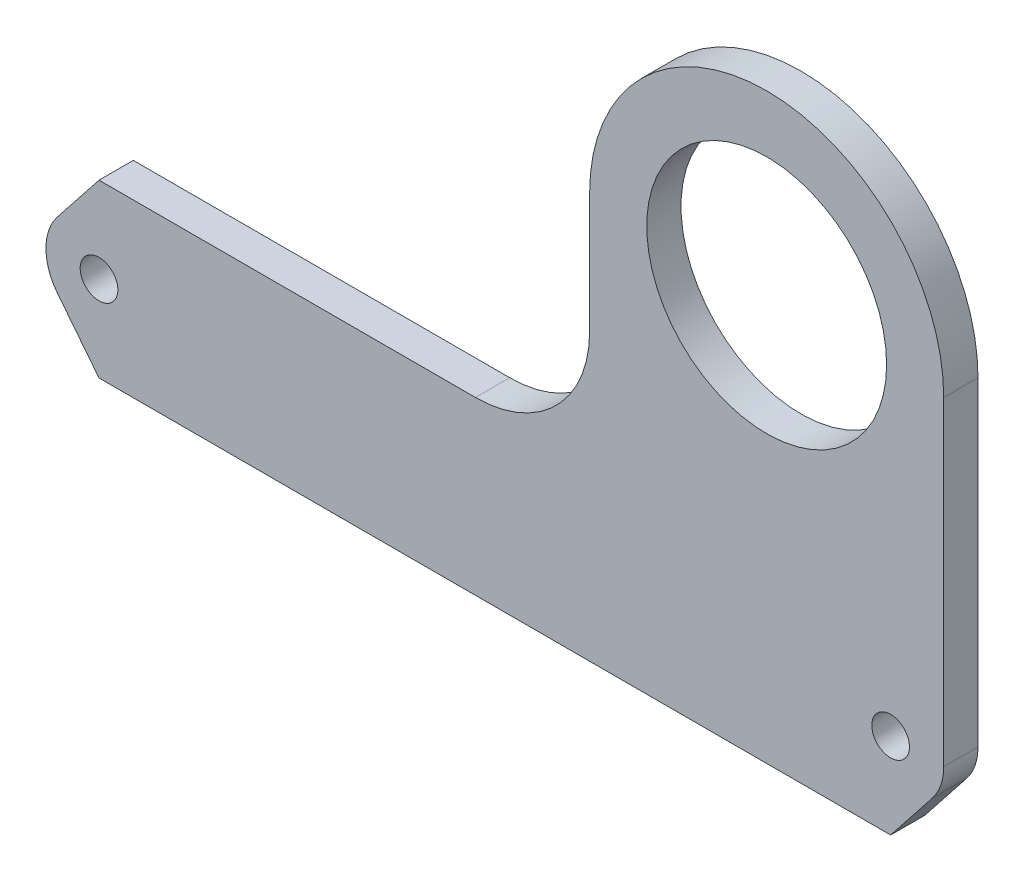
from build123d import *

# Parameters (mm, degrees)
SKETCH1_R           = 1.65
SKETCH1_R_2         = 10.5
BOSS_EXTRUDE1_DEPTH = 3


with BuildPart() as part:
    # Sketch1 → Boss-Extrude1 (new body)
    with BuildSketch(Plane.XY):
        with BuildLine():
            Line((0, 7.5), (32.95, 7.5))
            ThreePointArc((32.95, 7.5), (40.021067812, 10.428932188), (42.95, 17.5))
            Line((42.95, 17.5), (42.95, 28))
            ThreePointArc((42.95, 28), (58.45, 43.5), (73.95, 28))
            Line((73.95, 28), (73.95, 0))
            ThreePointArc((73.95, 0), (73.692468135, -1.526015624), (72.948398416, -2.883))
            Line((72.948398416, -2.883), (69.3, -7.5))
            Line((69.3, -7.5), (0, -7.5))
            Line((0, -7.5), (-3.648398416, -2.883))
            ThreePointArc((-3.648398416, -2.883), (-4.65, 0), (-3.648398416, 2.883))
            Line((-3.648398416, 2.883), (0, 7.5))
        make_face()
        Circle(SKETCH1_R, mode=Mode.SUBTRACT)
        with Locations((69.3, 0)):
            Circle(SKETCH1_R, mode=Mode.SUBTRACT)
        with Locations((58.45, 28)):
            Circle(SKETCH1_R_2, mode=Mode.SUBTRACT)
    extrude(amount=BOSS_EXTRUDE1_DEPTH)


solid = part.part
